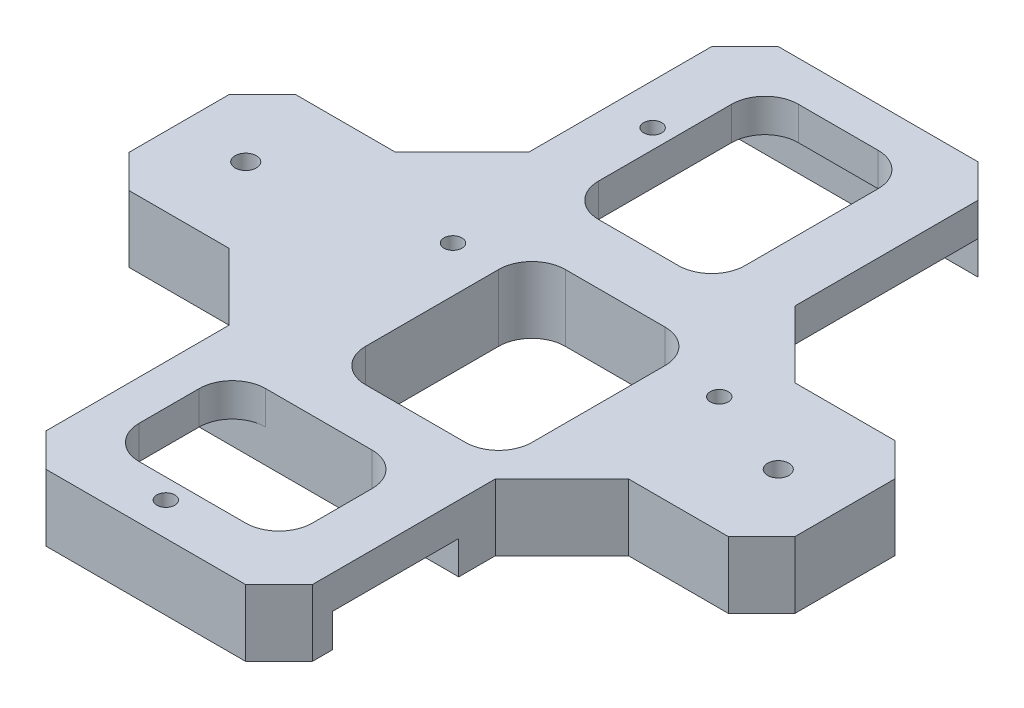
from build123d import *

# Parameters (mm, degrees)
SKETCH_1_R          = 1.6
SKETCH_1_R_2        = 1.35
EXTRUDE_1_DEPTH     = 10
SKETCH_2_R          = 3
CUT_EXTRUDE_1_DEPTH = 5
SKETCH_3_W          = 40
SKETCH_3_H          = 19
SKETCH_3_H_2        = 27.5
CUT_EXTRUDE_2_DEPTH = 5


with BuildPart() as part:
    # 草图1 → 凸台-拉伸1 (new body)
    with BuildSketch(Plane(origin=(0, 0, 0), x_dir=(1, 0, 0), z_dir=(0, 1, 0))):
        Polygon((-50, 7.5), (-50, -7.5), (-45, -12.5), (-30, -12.5), (-20, -22.5), (-20, -50), (-15, -55), (15, -55), (20, -50), (20, -22.5), (30, -12.5), (45, -12.5), (50, -7.5), (50, 7.5), (45, 12.5), (30, 12.5), (20, 22.5), (20, 50), (15, 55), (-15, 55), (-20, 50), (-20, 22.5), (-30, 12.5), (-45, 12.5), align=None)
        with Locations(Location((40, 0, 0), (0, 0, 270))):
            Circle(SKETCH_1_R, mode=Mode.SUBTRACT)
        with Locations(Location((-40, 0, 0), (0, 0, 270))):
            Circle(SKETCH_1_R, mode=Mode.SUBTRACT)
        with Locations(Location((-2, -50, 0), (0, 0, 270))):
            Circle(SKETCH_1_R_2, mode=Mode.SUBTRACT)
        with Locations(Location((-13.87, 5, 0), (0, 0, 270))):
            Circle(SKETCH_1_R_2, mode=Mode.SUBTRACT)
        with Locations(Location((26.13, 5, 0), (0, 0, 270))):
            Circle(SKETCH_1_R_2, mode=Mode.SUBTRACT)
        with Locations(Location((-13.87, 35, 0), (0, 0, 270))):
            Circle(SKETCH_1_R_2, mode=Mode.SUBTRACT)
        with BuildLine():
            Line((-6, 49), (6, 49))
            ThreePointArc((6, 49), (9.535533906, 47.535533906), (11, 44))
            Line((11, 44), (11, 24))
            ThreePointArc((11, 24), (9.535533906, 20.464466094), (6, 19))
            Line((6, 19), (-6, 19))
            ThreePointArc((-6, 19), (-9.535533906, 20.464466094), (-11, 24))
            Line((-11, 24), (-11, 44))
            ThreePointArc((-11, 44), (-9.535533906, 47.535533906), (-6, 49))
        make_face(mode=Mode.SUBTRACT)
        with BuildLine():
            Line((-9, -28), (7, -28))
            ThreePointArc((7, -28), (10.535533906, -29.464466094), (12, -33))
            Line((12, -33), (12, -42))
            ThreePointArc((12, -42), (10.535533906, -45.535533906), (7, -47))
            Line((7, -47), (-9, -47))
            ThreePointArc((-9, -47), (-12.535533906, -45.535533906), (-14, -42))
            Line((-14, -42), (-14, -33))
            ThreePointArc((-14, -33), (-12.535533906, -29.464466094), (-9, -28))
        make_face(mode=Mode.SUBTRACT)
        with BuildLine():
            Line((-2, 10), (13, 10))
            ThreePointArc((13, 10), (16.535533906, 8.535533906), (18, 5))
            Line((18, 5), (18, -15))
            ThreePointArc((18, -15), (16.535533906, -18.535533906), (13, -20))
            Line((13, -20), (-2, -20))
            ThreePointArc((-2, -20), (-5.535533906, -18.535533906), (-7, -15))
            Line((-7, -15), (-7, 5))
            ThreePointArc((-7, 5), (-5.535533906, 8.535533906), (-2, 10))
        make_face(mode=Mode.SUBTRACT)
    extrude(amount=EXTRUDE_1_DEPTH)

    # 草图2 → 切除-拉伸1 (cut)
    with BuildSketch(Plane.XZ):
        with Locations(Location((-40, 0, 0), (0, 0, 270))):
            Circle(SKETCH_2_R)
        with Locations(Location((40, 0, 0), (0, 0, 270))):
            Circle(SKETCH_2_R)
    extrude(amount=-CUT_EXTRUDE_1_DEPTH, mode=Mode.SUBTRACT)

    # 草图3 → 切除-拉伸2 (cut)
    with BuildSketch(Plane.XZ):
        with Locations((0, 37.5)):
            Rectangle(SKETCH_3_W, SKETCH_3_H)
        with Locations((0, -36.25)):
            Rectangle(SKETCH_3_W, SKETCH_3_H_2)
    extrude(amount=-CUT_EXTRUDE_2_DEPTH, mode=Mode.SUBTRACT)


solid = part.part
